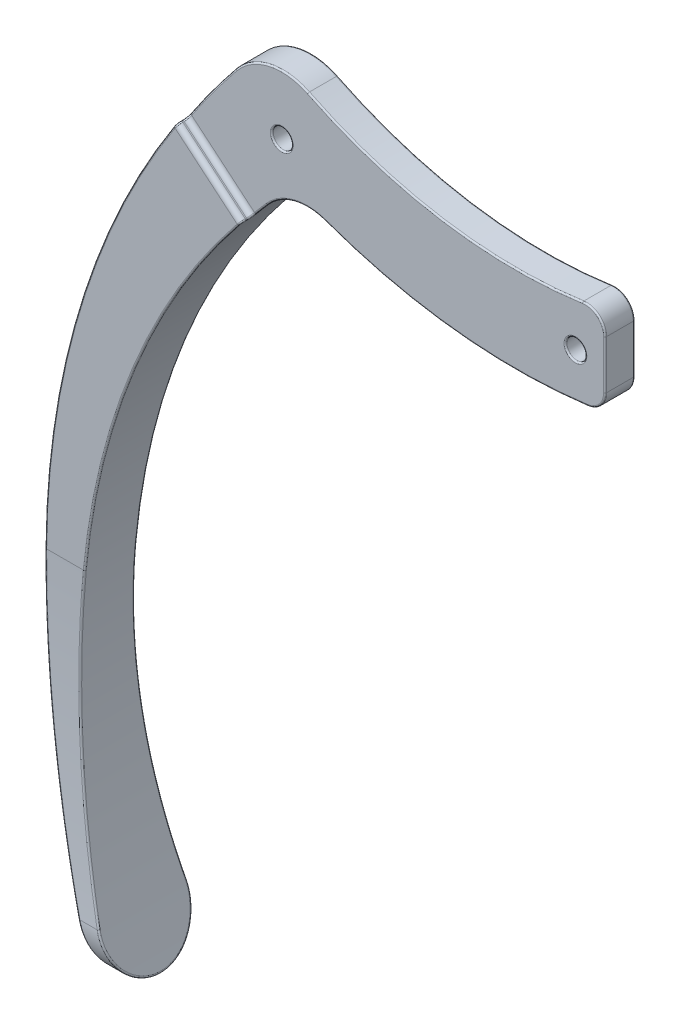
from build123d import *

# Parameters (mm, degrees)
BOSS_EXTRUDE1_DEPTH = 5
CUT_EXTRUDE1_DEPTH  = 96.78611619581834
SKETCH4_R           = 1.0000000000000016
SKETCH4_R_2         = 0.9999999999999983
BOSS_EXTRUDE3_DEPTH = 1.5
FILLET1_R           = 2
FILLET2_R           = 0.5
FILLET4_R           = 0.15


with BuildPart() as part:
    # Sketch2 → Boss-Extrude1 (new, symmetric)
    with BuildSketch(Plane.XY):
        with BuildLine():
            Line((-35.61677307374678, -5.1139788500938685), (-42.14657167396252, 0.36517274700914504))
            ThreePointArc((-42.14657167396252, 0.36517274700914504), (-55.21278829581432, -38.05080670233517), (-47.879999999999995, -77.96))
            Line((-47.879999999999995, -77.96), (-46.08000000000003, -77.95999999999995))
            ThreePointArc((-46.08000000000003, -77.95999999999995), (-51.023336027629995, -40.07551213631665), (-35.61677307374678, -5.1139788500938685))
        make_face()
    extrude(amount=BOSS_EXTRUDE1_DEPTH, both=True)

    # Sketch3 → Cut-Extrude1 (cut, through all)
    with BuildSketch(Plane(origin=(0, 0, 0), x_dir=(0, 0, -1), z_dir=(1, 0, 0))):
        with BuildLine():
            Line((-2.625000000000016, -43.43482725299087), (-2.625000000000014, 5.065172747009132))
            Line((-2.625000000000014, 5.065172747009132), (-26.73081867687638, 5.065172747009132))
            Line((-26.73081867687638, 5.065172747009132), (-26.73081867687638, -87.63923991370886))
            Line((-26.73081867687638, -87.63923991370886), (29.14622212654469, -87.63923991370886))
            Line((29.14622212654469, -87.63923991370886), (29.14622212654469, 5.065172747009132))
            Line((29.14622212654469, 5.065172747009132), (2.6249999999999862, 5.065172747009132))
            Line((2.6249999999999862, 5.065172747009132), (2.6249999999999885, -43.43482725299087))
            ThreePointArc((2.6249999999999885, -43.43482725299087), (3.085160384478854, -57.9291496861807), (4.463788201212424, -72.36509495206636))
            ThreePointArc((4.463788201212424, -72.36509495206636), (2.8e-16, -77.43482725299087), (-4.463788201212424, -72.36509495206636))
            ThreePointArc((-4.463788201212424, -72.36509495206636), (-3.0851603844788826, -57.92914968618077), (-2.625000000000016, -43.43482725299087))
        make_face()
    extrude(amount=-CUT_EXTRUDE1_DEPTH, mode=Mode.SUBTRACT)

    # Sketch4 → Boss-Extrude3 (add, symmetric)
    with BuildSketch(Plane.XY):
        with BuildLine():
            Line((-42.14657167396252, 0.36517274700913205), (-35.61677307374678, -5.113978850093869))
            ThreePointArc((-35.61677307374678, -5.113978850093869), (-34.866186015261, -4.215083216037343), (-34.10087528247609, -3.3286895249629826))
            ThreePointArc((-34.10087528247609, -3.3286895249629826), (-31.40696113293947, -1.6753615348371014), (-28.25000000000002, -1.8311283256397803))
            ThreePointArc((-28.25000000000002, -1.8311283256397803), (-14.296057215547194, -4.9762043616846015), (0, -4.5))
            Line((0, -4.5), (-1.89e-15, 4.5))
            ThreePointArc((-1.89e-15, 4.5), (-15.33133593836877, 4.0605600218813365), (-30.000000000000004, 8.54087963062524))
            ThreePointArc((-30.000000000000004, 8.54087963062524), (-33.93122101127035, 9.02524943255605), (-37.307650996251546, 6.954299577780251))
            ThreePointArc((-37.307650996251546, 6.954299577780251), (-39.810809051217305, 3.7212020621360367), (-42.14657167396252, 0.36517274700913205))
        make_face()
        with Locations((-2.999999999999999, -0.43939596637677164)):
            Circle(SKETCH4_R, mode=Mode.SUBTRACT)
        with Locations((-32.65820594205033, 3.161851728703884)):
            Circle(SKETCH4_R_2, mode=Mode.SUBTRACT)
    extrude(amount=BOSS_EXTRUDE3_DEPTH, both=True)

    # Fillet1
    fillet1_edges = [part.edges().sort_by_distance(p)[0] for p in [
        (-1.83e-15, 4.5, 0),
        (0, -4.5000000000000036, 0),
    ]]
    fillet(fillet1_edges, radius=FILLET1_R)

    # Fillet2
    fillet2_edges = [part.edges().sort_by_distance(p)[0] for p in [
        (-38.881672373854656, -2.374403051542359, -2.6249999999999867),
        (-38.881672373854656, -2.374403051542359, 2.625000000000014),
        (-38.88167237385465, -2.3744030515423686, 1.5),
        (-38.88167237385465, -2.3744030515423686, -1.5),
    ]]
    fillet(fillet2_edges, radius=FILLET2_R)

    # Fillet4
    fillet4_edges = [part.edges().sort_by_distance(p)[0] for p in [
        (-16.476993443243735, 4.229151933871357, 1.5),
        (-0.6899206010633085, 3.6470058549128215, 1.5),
        (-0.49724689556412227, -4.091082311496693, 1.5),
        (-42.14657167396253, 0.3651727470091497, -2.062499999999993),
        (-35.61677307374678, -5.113978850093867, -2.062499999999994),
        (-34.704033328749276, -4.024794283693069, -1.5),
        (-52.03741881296645, -20.81223143966389, -2.624999999999989),
        (-42.14657167396253, 0.3651727470091497, 2.062500000000007),
        (-42.227942170174785, 0.24143712600635725, 2.479196523584946),
        (-42.22794218429943, 0.24143710448469663, -2.4791965490575922),
        (-34.704033328749276, -4.024794283693069, 1.5),
        (-35.61677307374678, -5.113978850093867, 2.062500000000007),
        (-46.47449317188725, -23.326359947723184, 2.625000000000016),
        (-35.70960382732004, -5.227272332593701, 2.478565072747312),
        (-35.70960382732004, -5.227272332593701, -2.4785650727472843),
        (-35.5237176414439, -5.000887834211708, -1.6464455956348794),
        (-42.065048691333786, 0.4886450841584614, -1.6459067834750976),
        (-35.52371764144391, -5.000887834211708, 1.6464455956348791),
        (-42.065048691333786, 0.48864508415846186, 1.645906783475097),
        (-54.158464105974055, -58.16567318670178, -3.100316822202103),
        (-48.122699023718155, -77.43482725299087, -1.86e-15),
        (-54.15846410597407, -58.16567318670176, 3.1003168222021396),
        (-52.03741881296645, -20.812231439663893, 2.625000000000016),
        (-51.30086780822025, -58.09540683040743, 3.0957884353357463),
        (-46.30089487518959, -77.43482725299087, -1.86e-15),
        (-51.30086780822026, -58.09540683040745, -3.0957884353357077),
        (-46.47449317188725, -23.326359947723184, -2.624999999999989),
        (-33.93122101127035, 9.025249432556048, 1.5),
        (-39.661574887117155, 3.923749060527598, 1.5),
        (-31.40696113293947, -1.6753615348371014, 1.5),
        (-15.171628761397878, -4.886569672435449, 1.5),
        (-33.93122101127035, 9.025249432556048, -1.5),
        (-39.661574887117155, 3.923749060527598, -1.5),
        (-31.40696113293947, -1.6753615348371014, -1.5),
        (-15.171628761397878, -4.886569672435449, -1.5),
        (-4.000000000000001, -0.43939596637677153, 1.5),
        (-33.65820594205033, 3.161851728703884, 1.5),
        (-8.8e-16, -0.3177590085898778, -1.5),
        (-8.8e-16, -0.3177590085898778, 1.5),
        (-16.476993443243735, 4.229151933871357, -1.5),
        (-0.6899206010633085, 3.6470058549128215, -1.5),
        (-0.49724689556412227, -4.091082311496693, -1.5),
    ]]
    fillet(fillet4_edges, radius=FILLET4_R)


solid = part.part
